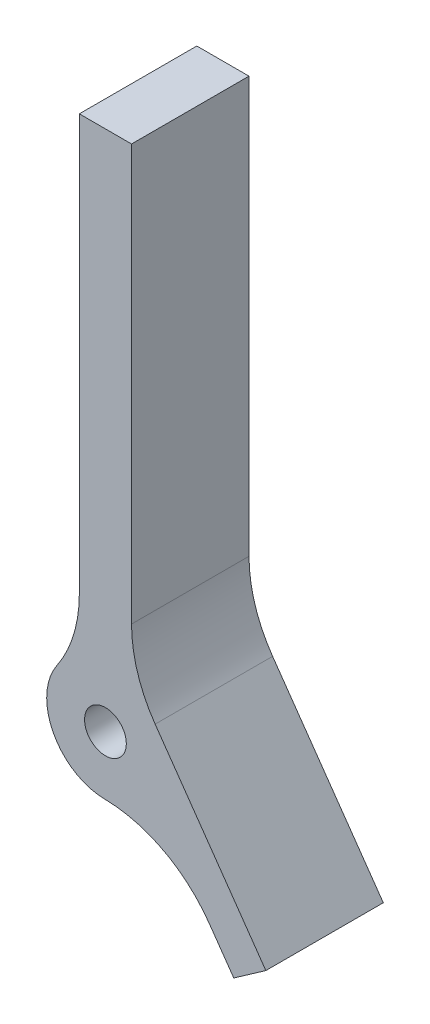
from build123d import *

# Parameters (mm, degrees)
SKETCH1_R           = 1.6
BOSS_EXTRUDE1_DEPTH = 9
FILLET1_R           = 10


with BuildPart() as part:
    # Sketch1 → Boss-Extrude1 (new body)
    with BuildSketch(Plane.XY):
        with BuildLine():
            Line((-3.813815801, 22.581093964), (4.789830745, 10.293813299))
            Line((4.789830745, 10.293813299), (2.332374612, 8.57308399))
            Line((2.332374612, 8.57308399), (-3.837793208, 17.384996862))
            ThreePointArc((-3.837793208, 17.384996862), (-10.92541976, 17.081695789), (-9.5, 24.031128874))
            Line((-9.5, 24.031128874), (-9.5, 60))
            Line((-9.5, 60), (-5.5, 60))
            Line((-5.5, 60), (-5.5, 24.031128874))
            ThreePointArc((-5.5, 24.031128874), (-4.565920417, 23.41191691), (-3.813815801, 22.581093964))
        make_face()
        with Locations((-7.5, 20)):
            Circle(SKETCH1_R, mode=Mode.SUBTRACT)
    extrude(amount=BOSS_EXTRUDE1_DEPTH)

    # Fillet1
    fillet1_edges = [part.edges().sort_by_distance(p)[0] for p in [
        (-3.837793208, 17.384996862, 4.5),
        (-9.5, 24.031128874, 4.5),
        (-5.5, 24.031128874, 4.5),
    ]]
    fillet(fillet1_edges, radius=FILLET1_R)


solid = part.part
